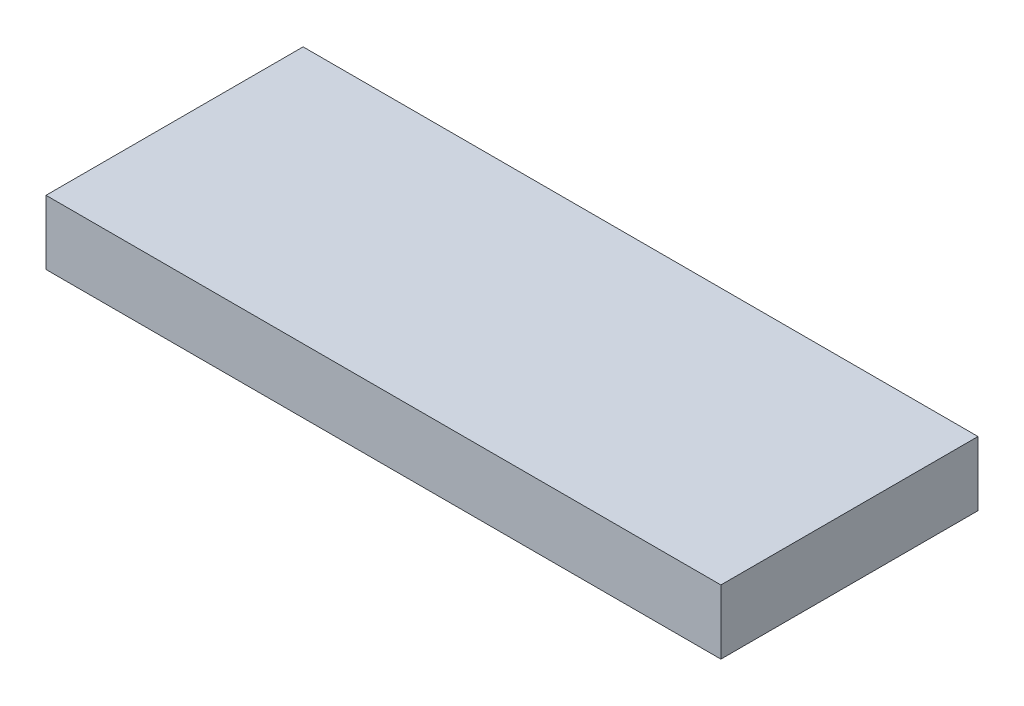
from build123d import *

# Parameters (mm, degrees)
SKETCH1_W           = 133.35
SKETCH1_H           = 50.8
BOSS_EXTRUDE1_DEPTH = 12.7


with BuildPart() as part:
    # Sketch1 → Boss-Extrude1 (new body)
    with BuildSketch(Plane(origin=(0, 0, 0), x_dir=(1, 0, 0), z_dir=(0, 1, 0))):
        Rectangle(SKETCH1_W, SKETCH1_H)
    extrude(amount=BOSS_EXTRUDE1_DEPTH)


solid = part.part
